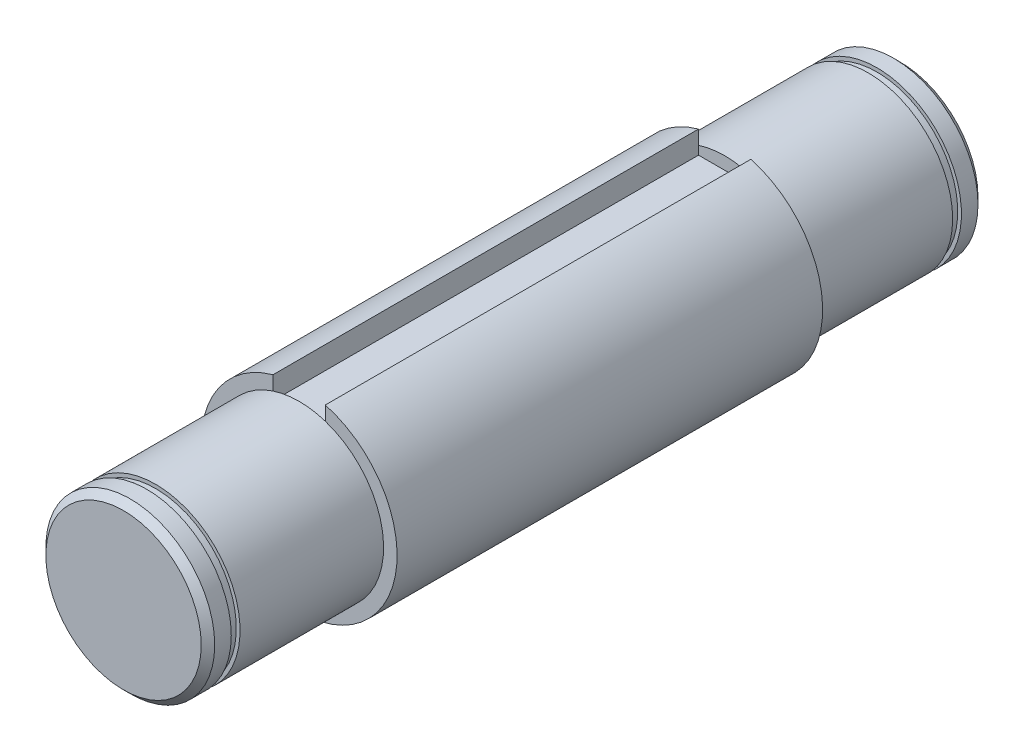
from build123d import *

# Parameters (mm, degrees)
SKETCH1_R                      = 12.5
BOSS_EXTRUDE1_DEPTH            = 115
BOSS_EXTRUDE2_DEPTH            = 31.5
BOSS_EXTRUDE2_DEPTH_BACK       = 31.5
SKETCH2_R                      = 14.5
CUT_EXTRUDE1_REACH             = 63.047
SKETCH3_W                      = 7.75
SKETCH3_H                      = 7.75
CUT_EXTRUDE1_DIRECTION_2_REACH = 63.047
SKETCH4_W                      = 1.1
SKETCH4_H                      = 1.3
CHAMFER1_SIZE                  = 1


with BuildPart() as part:
    # Sketch1 → Boss-Extrude1 (new body)
    with BuildSketch(Plane.XY):
        Circle(SKETCH1_R)
    extrude(amount=BOSS_EXTRUDE1_DEPTH)

    # Sketch2 → Boss-Extrude2 (add, two sides: drawn at the far end of the back side and taken through both)
    with BuildSketch(Plane(origin=(0, 0, 57.5), x_dir=(-1, 0, 0), z_dir=(0, 0, -1)).offset(-BOSS_EXTRUDE2_DEPTH_BACK)):
        Circle(SKETCH2_R)
    extrude(amount=BOSS_EXTRUDE2_DEPTH + BOSS_EXTRUDE2_DEPTH_BACK)

    # Cut-Extrude1: up to this face of the body (flat: up to its plane)
    cut_extrude1_end = Plane(part.part.faces().sort_by_distance((14.089878067, 0, 89))[0])
    # Sketch3 → Cut-Extrude1 (cut, up to the picked face)
    with BuildSketch(Plane(origin=(0, 0, 57.5), x_dir=(-1, 0, 0), z_dir=(0, 0, -1)), mode=Mode.PRIVATE) as cut_extrude1_sk1:
        with Locations((0, 14.5)):
            Rectangle(SKETCH3_W, SKETCH3_H)
    cut_extrude1_tool1 = split(extrude(cut_extrude1_sk1.sketch, amount=-CUT_EXTRUDE1_REACH, mode=Mode.PRIVATE), bisect_by=cut_extrude1_end, keep=Keep.BOTH, mode=Mode.PRIVATE)
    add(cut_extrude1_tool1.solids().sort_by(Axis((0, 14.5, 57.5), (0, 0, 1)))[0], mode=Mode.SUBTRACT)

    # Cut-Extrude1 direction 2: up to this face of the body (flat: up to its plane)
    cut_extrude1_direction_2_end = Plane(part.part.faces().sort_by_distance((14.089878067, 0, 26))[0])
    # Sketch3 → Cut-Extrude1 direction 2 (cut, up to the picked face)
    with BuildSketch(Plane(origin=(0, 0, 57.5), x_dir=(-1, 0, 0), z_dir=(0, 0, -1)), mode=Mode.PRIVATE) as cut_extrude1_direction_2_sk1:
        with Locations((0, 14.5)):
            Rectangle(SKETCH3_W, SKETCH3_H)
    cut_extrude1_direction_2_tool1 = split(extrude(cut_extrude1_direction_2_sk1.sketch, amount=CUT_EXTRUDE1_DIRECTION_2_REACH, mode=Mode.PRIVATE), bisect_by=cut_extrude1_direction_2_end, keep=Keep.BOTH, mode=Mode.PRIVATE)
    add(cut_extrude1_direction_2_tool1.solids().sort_by(Axis((0, 14.5, 57.5), (0, 0, -1)))[0], mode=Mode.SUBTRACT)

    # Sketch4 → Cut-Revolve1 (revolve, cut)
    with BuildSketch(Plane(origin=(0, 0, 0), x_dir=(1, 0, 0), z_dir=(0, 1, 0)), mode=Mode.PRIVATE) as cut_revolve1_sk:
        with Locations((-12.5, -4.1)):
            Rectangle(SKETCH4_W, SKETCH4_H)
    cut_revolve1 = revolve(cut_revolve1_sk.sketch.rotate(Axis((0, 0, 0), (0, 0, 1)), 288.059230491), axis=Axis((0, 0, 0), (0, 0, 1)), mode=Mode.SUBTRACT)

    # Mirror1: Cut-Revolve1 across plane
    add(cut_revolve1.mirror(Plane(origin=(0, 0, 57.5), x_dir=(1, 0, 0), z_dir=(0, 0, -1))), mode=Mode.SUBTRACT)

    # Chamfer1
    chamfer1_edges = [part.edges().sort_by_distance(p)[0] for p in [
        (-12.5, 0, 0),
        (-12.5, 0, 115),
    ]]
    chamfer(chamfer1_edges, length=CHAMFER1_SIZE)


solid = part.part
